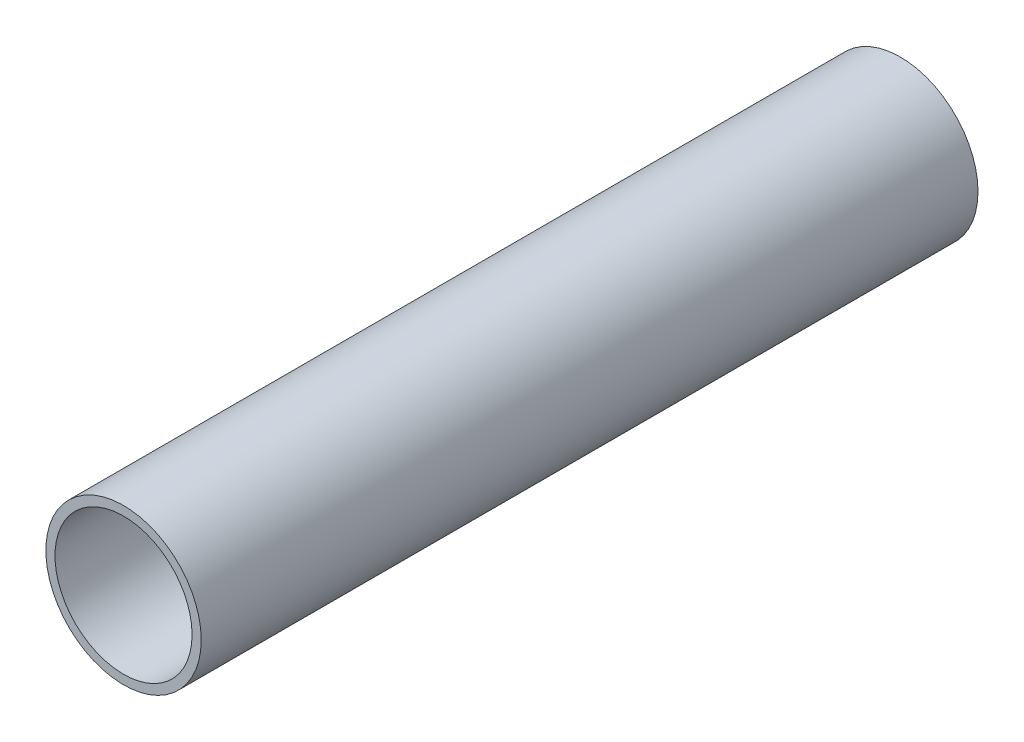
from build123d import *

# Parameters (mm, degrees)
SKETCH1_R           = 17
SKETCH1_R_2         = 15
BOSS_EXTRUDE1_DEPTH = 85


with BuildPart() as part:
    # Sketch1 → Boss-Extrude1 (new, symmetric)
    with BuildSketch(Plane.XY):
        Circle(SKETCH1_R)
        Circle(SKETCH1_R_2, mode=Mode.SUBTRACT)
    extrude(amount=BOSS_EXTRUDE1_DEPTH, both=True)


solid = part.part
